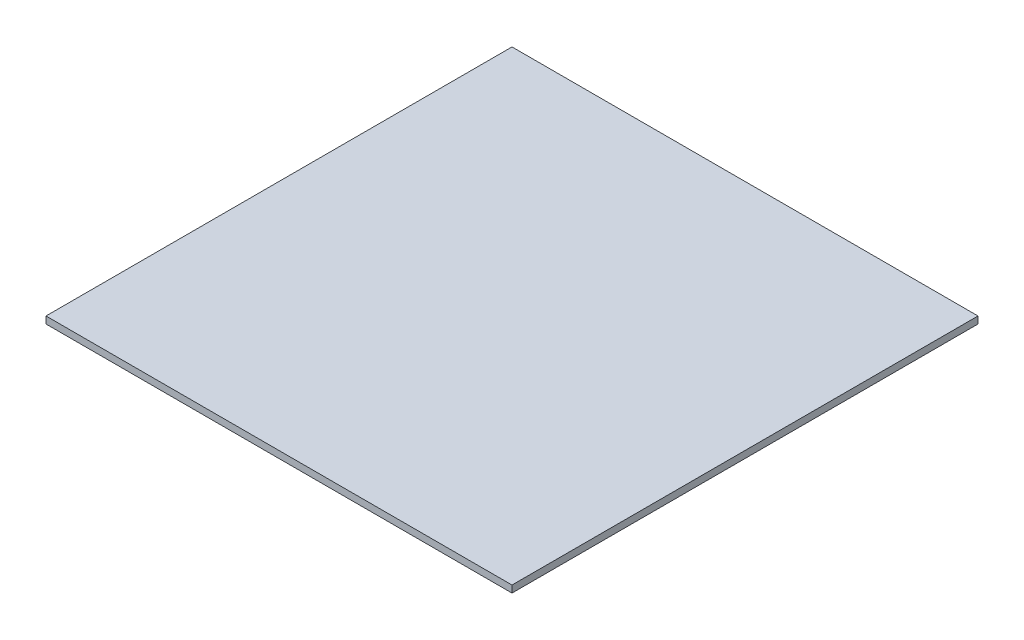
from build123d import *

# Parameters (mm, degrees)
SKETCH1_W           = 100
SKETCH1_H           = 100
BOSS_EXTRUDE1_DEPTH = 1.5


with BuildPart() as part:
    # Sketch1 → Boss-Extrude1 (new body)
    with BuildSketch(Plane(origin=(0, 0, 0), x_dir=(1, 0, 0), z_dir=(0, 1, 0))):
        Rectangle(SKETCH1_W, SKETCH1_H)
    extrude(amount=BOSS_EXTRUDE1_DEPTH)


solid = part.part
